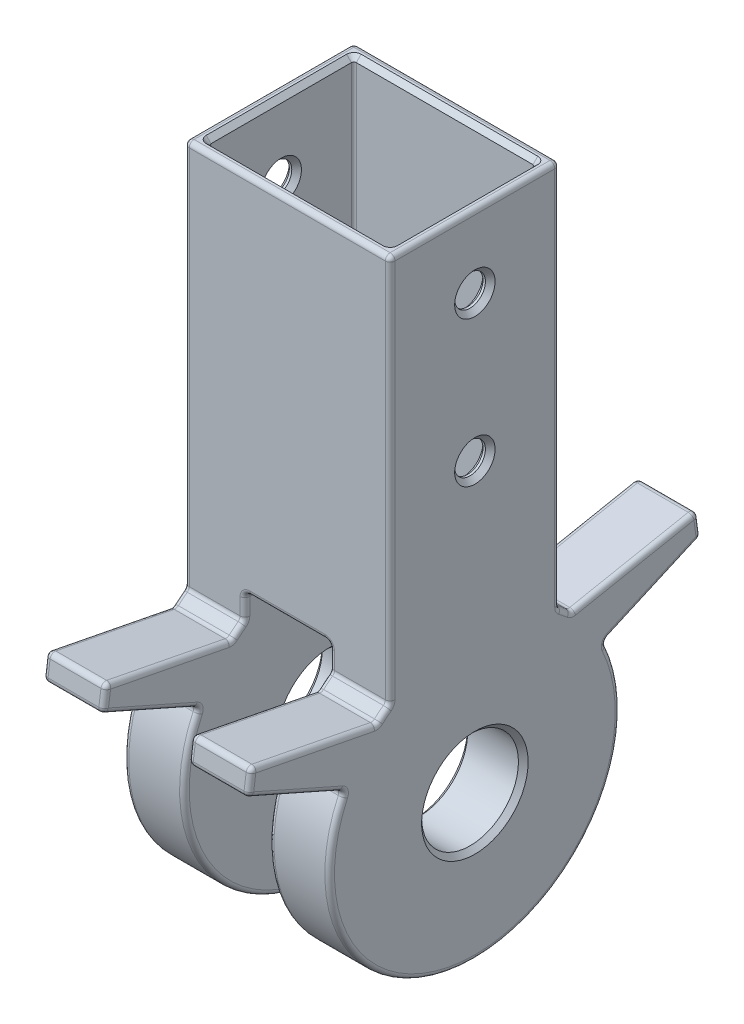
from build123d import *

# Parameters (mm, degrees)
SKETCH1_R               = 10
BOSS_EXTRUDE1_DEPTH     = 42.5
CUT_EXTRUDE1_DEPTH      = 90
CUT_EXTRUDE1_DEPTH_BACK = 90
SKETCH2_W               = 17.5
SKETCH2_H               = 75
CUT_EXTRUDE2_START      = 17.5
SKETCH3_R               = 30
CUT_EXTRUDE2_DEPTH      = 17.5
SKETCH4_R               = 3.175
CUT_EXTRUDE3_DEPTH      = 123.009074061
FILLET1_R               = 1
CHAMFER1_SIZE           = 1
SKETCH5_W               = 37.5
SKETCH5_H               = 30
CUT_EXTRUDE4_DEPTH      = 65
FILLET2_R               = 0.5
CHAMFER2_SIZE           = 1


with BuildPart() as part:
    # Sketch1 → Boss-Extrude1 (new body)
    with BuildSketch(Plane(origin=(0, 0, 0), x_dir=(0, 0, -1), z_dir=(1, 0, 0))):
        with BuildLine():
            Line((20.110484966, 22.261365511), (46.110484966, 27.345056416))
            Line((46.110484966, 27.345056416), (46.770679013, 22.388833679))
            Line((46.770679013, 22.388833679), (26.770679013, 13.539968433))
            ThreePointArc((26.770679013, 13.539968433), (0, -30), (-26.770679013, 13.539968433))
            Line((-26.770679013, 13.539968433), (-46.770679013, 22.388833679))
            Line((-46.770679013, 22.388833679), (-46.110484966, 27.345056416))
            Line((-46.110484966, 27.345056416), (-20.110484966, 22.261365511))
            ThreePointArc((-20.110484966, 22.261365511), (-18.834690178, 23.350684056), (-17.5, 24.366985862))
            Line((-17.5, 24.366985862), (-17.5, 104.366985862))
            Line((-17.5, 104.366985862), (17.5, 104.366985862))
            Line((17.5, 104.366985862), (17.5, 24.366985862))
            ThreePointArc((17.5, 24.366985862), (18.834690178, 23.350684056), (20.110484966, 22.261365511))
        make_face()
        Circle(SKETCH1_R, mode=Mode.SUBTRACT)
    extrude(amount=BOSS_EXTRUDE1_DEPTH)

    # Sketch2 → Cut-Extrude1 (cut, two sides: drawn at the far end of the back side and taken through both)
    with BuildSketch(Plane.XY.offset(-CUT_EXTRUDE1_DEPTH_BACK)):
        with Locations((21.25, -8.133014138)):
            Rectangle(SKETCH2_W, SKETCH2_H)
    extrude(amount=CUT_EXTRUDE1_DEPTH + CUT_EXTRUDE1_DEPTH_BACK, mode=Mode.SUBTRACT)

    # Sketch3 → Cut-Extrude2 (cut)
    with BuildSketch(Plane.ZY.offset(-30).offset(CUT_EXTRUDE2_START)):
        Circle(SKETCH3_R)
    extrude(amount=-CUT_EXTRUDE2_DEPTH, mode=Mode.SUBTRACT)

    # Sketch4 → Cut-Extrude3 (cut, through all)
    with BuildSketch(Plane(origin=(42.5, 0, 0), x_dir=(0, 0, -1), z_dir=(1, 0, 0))):
        with Locations((0, 59.366985862)):
            Circle(SKETCH4_R)
        with Locations((0, 89.366985862)):
            Circle(SKETCH4_R)
    extrude(amount=-CUT_EXTRUDE3_DEPTH, mode=Mode.SUBTRACT)

    # Fillet1
    fillet1_edges = [part.edges().sort_by_distance(p)[0] for p in [
        (0, 24.803210964, -33.110484966),
        (0, 24.866945048, -46.44058199),
        (42.5, 104.366985862, 0),
        (0, 17.964401056, -36.770679013),
        (0, -30, 0),
        (0, 17.964401056, 36.770679013),
        (0, 24.866945048, 46.44058199),
        (0, 24.803210964, 33.110484966),
        (0, 23.350684056, 18.834690178),
        (0, 64.366985862, 17.5),
        (0, 104.366985862, 0),
        (0, 64.366985862, -17.5),
        (0, 23.350684056, -18.834690178),
        (42.5, 64.366985862, 17.5),
        (36.25, 22.261365511, -20.110484966),
        (36.25, 27.345056416, -46.110484966),
        (36.25, 22.388833679, -46.770679013),
        (42.5, 23.350684056, 18.834690178),
        (36.25, 13.539968433, -26.770679013),
        (36.25, 13.539968433, 26.770679013),
        (36.25, 22.388833679, 46.770679013),
        (36.25, 27.345056416, 46.110484966),
        (36.25, 22.261365511, 20.110484966),
        (36.25, 24.366985862, 17.5),
        (21.25, 104.366985862, 17.5),
        (21.25, 104.366985862, -17.5),
        (36.25, 24.366985862, -17.5),
        (42.5, 24.803210964, 33.110484966),
        (42.5, 24.866945048, 46.44058199),
        (42.5, 17.964401056, 36.770679013),
        (42.5, -30, 0),
        (6.25, 22.261365511, -20.110484966),
        (6.25, 27.345056416, -46.110484966),
        (42.5, 17.964401056, -36.770679013),
        (6.25, 22.388833679, -46.770679013),
        (6.25, 13.539968433, -26.770679013),
        (6.25, 13.539968433, 26.770679013),
        (42.5, 24.866945048, -46.44058199),
        (6.25, 22.388833679, 46.770679013),
        (6.25, 27.345056416, 46.110484966),
        (42.5, 24.803210964, -33.110484966),
        (6.25, 22.261365511, 20.110484966),
        (42.5, 23.350684056, -18.834690178),
        (6.25, 24.366985862, 17.5),
        (21.25, 29.366985862, 17.5),
        (6.25, 24.366985862, -17.5),
        (21.25, 29.366985862, -17.5),
        (12.5, 29.366985862, -11.81513219),
        (30, 29.366985862, -11.81513219),
        (12.5, 26.866985862, -17.5),
        (12.5, 23.350684056, -18.834690178),
        (12.5, 24.803210964, -33.110484966),
        (12.5, 24.866945048, -46.44058199),
        (12.5, 17.964401056, -36.770679013),
        (12.5, -30, 0),
        (12.5, 17.964401056, 36.770679013),
        (12.5, 24.866945048, 46.44058199),
        (12.5, 24.803210964, 33.110484966),
        (12.5, 23.350684056, 18.834690178),
        (12.5, 26.866985862, 17.5),
        (30, 26.866985862, -17.5),
        (30, 23.350684056, -18.834690178),
        (30, 24.803210964, -33.110484966),
        (30, 24.866945048, -46.44058199),
        (30, 17.964401056, -36.770679013),
        (30, -30, 0),
        (30, 17.964401056, 36.770679013),
        (30, 24.866945048, 46.44058199),
        (30, 24.803210964, 33.110484966),
        (30, 23.350684056, 18.834690178),
        (30, 26.866985862, 17.5),
        (12.5, 29.366985862, 11.81513219),
        (30, 29.366985862, 11.81513219),
        (12.5, 30, 0),
        (30, 30, 0),
        (21.25, 29.366985862, 6.130264381),
        (21.25, 29.366985862, -6.130264381),
        (42.5, 64.366985862, -17.5),
    ]]
    fillet(fillet1_edges, radius=FILLET1_R)

    # Chamfer1
    chamfer1_edges = [part.edges().sort_by_distance(p)[0] for p in [
        (0, 89.366985862, 3.175),
        (42.5, 89.366985862, 3.175),
        (0, 59.366985862, 3.175),
        (42.5, 59.366985862, 3.175),
        (0, 0, 10),
        (42.5, 0, 10),
        (30, 0, 10),
        (12.5, 0, 10),
    ]]
    chamfer(chamfer1_edges, length=CHAMFER1_SIZE)

    # Sketch5 → Cut-Extrude4 (cut)
    with BuildSketch(Plane(origin=(0, 104.366985862, 0), x_dir=(1, 0, 0), z_dir=(0, 1, 0))):
        with Locations((21.25, 0)):
            Rectangle(SKETCH5_W, SKETCH5_H)
    extrude(amount=-CUT_EXTRUDE4_DEPTH, mode=Mode.SUBTRACT)

    # Fillet2
    fillet2_edges = [part.edges().sort_by_distance(p)[0] for p in [
        (2.5, 39.366985862, 0),
        (2.5, 71.866985862, 15),
        (40, 39.366985862, 0),
        (40, 71.866985862, -15),
        (21.25, 39.366985862, 15),
        (40, 71.866985862, 15),
        (21.25, 39.366985862, -15),
        (2.5, 71.866985862, -15),
    ]]
    fillet(fillet2_edges, radius=FILLET2_R)

    # Chamfer2
    chamfer2_edges = [part.edges().sort_by_distance(p)[0] for p in [
        (2.5, 89.366985862, 3.175),
        (2.5, 59.366985862, 3.175),
        (40, 89.366985862, 3.175),
        (40, 59.366985862, 3.175),
        (2.5, 104.366985862, 0),
        (21.25, 104.366985862, -15),
        (40, 104.366985862, 0),
        (21.25, 104.366985862, 15),
        (2.646446609, 104.366985862, 14.853553391),
        (39.853553391, 104.366985862, 14.853553391),
        (39.853553391, 104.366985862, -14.853553391),
        (2.646446609, 104.366985862, -14.853553391),
    ]]
    chamfer(chamfer2_edges, length=CHAMFER2_SIZE)


solid = part.part
